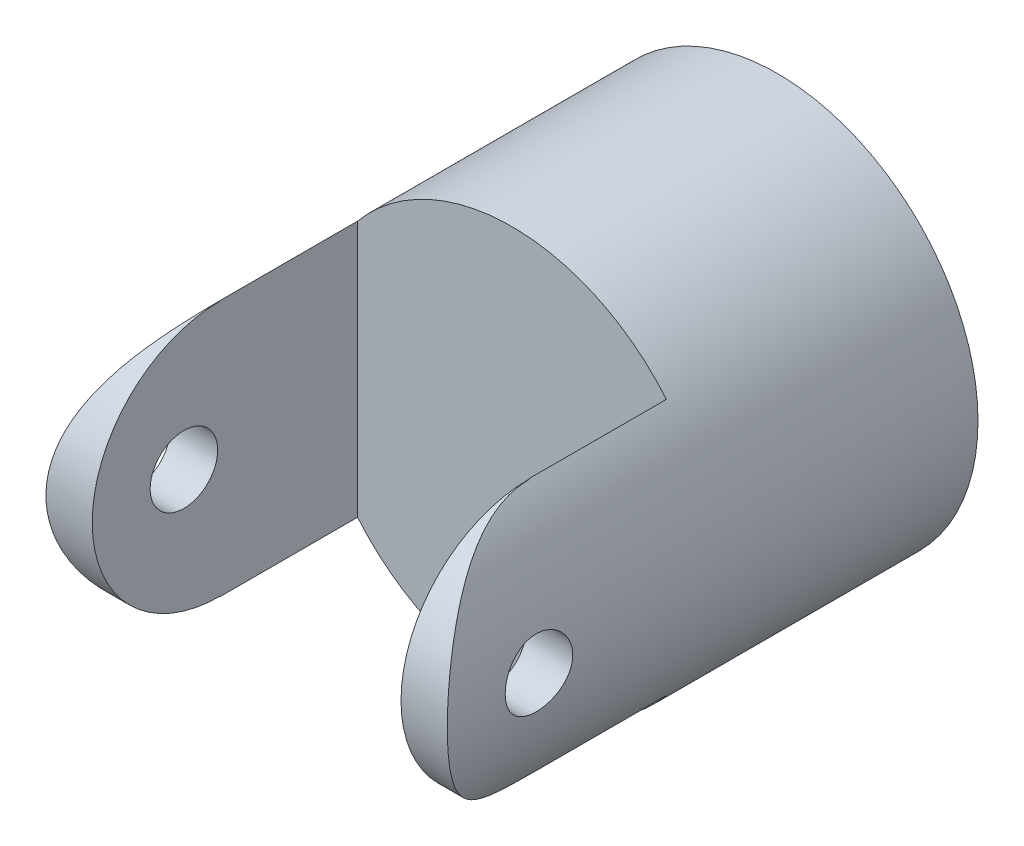
from build123d import *

# Parameters (mm, degrees)
SKETCH1_R           = 4.16
EXTRUDE1_DEPTH      = 11
EXTRUDE2_DEPTH      = 13.47442183
EXTRUDE2_DEPTH_BACK = 13.47442183
SKETCH2_W           = 6.4
SKETCH2_H           = 6.357406019
EXTRUDE3_DEPTH      = 13.47442183
EXTRUDE3_DEPTH_BACK = 13.47442183
EXTRUDE4_DEPTH      = 13.474421985
EXTRUDE4_DEPTH_BACK = 13.474421985
SKETCH4_R           = 0.7


with BuildPart() as part:
    # Sketch1 → Extrude1 (new body)
    with BuildSketch(Plane.XY):
        Circle(SKETCH1_R)
    extrude(amount=EXTRUDE1_DEPTH)

    # Sketch2 → Extrude2 (cut, two sides: drawn at the far end of the back side and taken through both)
    with BuildSketch(Plane(origin=(0, 0, 0), x_dir=(1, 0, 0), z_dir=(0, 1, 0)).offset(-EXTRUDE2_DEPTH_BACK)):
        with Locations((0, -8.67870301)):
            Rectangle(SKETCH2_W, SKETCH2_H)
    extrude(amount=EXTRUDE2_DEPTH + EXTRUDE2_DEPTH_BACK, mode=Mode.SUBTRACT)

    # Sketch3 → Extrude3 (cut, two sides: drawn at the far end of the back side and taken through both)
    with BuildSketch(Plane(origin=(0, 0, 0), x_dir=(0, 0, -1), z_dir=(1, 0, 0)).offset(-EXTRUDE3_DEPTH_BACK)):
        with BuildLine():
            Line((-8.35, 2.65), (-8.35, 3.836721977))
            Line((-8.35, 3.836721977), (-12.822156105, 3.836721977))
            Line((-12.822156105, 3.836721977), (-12.822156105, -4.605164147))
            Line((-12.822156105, -4.605164147), (-8.35, -4.492230912))
            Line((-8.35, -4.492230912), (-8.35, -2.65))
            ThreePointArc((-8.35, -2.65), (-11, 0), (-8.35, 2.65))
        make_face()
    extrude(amount=EXTRUDE3_DEPTH + EXTRUDE3_DEPTH_BACK, mode=Mode.SUBTRACT)

    # Sketch4 → Extrude4 (cut, two sides: drawn at the far end of the back side and taken through both)
    with BuildSketch(Plane(origin=(0, 0, 0), x_dir=(0, 0, -1), z_dir=(1, 0, 0)).offset(-EXTRUDE4_DEPTH_BACK)):
        with Locations((-9.1, 0)):
            Circle(SKETCH4_R)
    extrude(amount=EXTRUDE4_DEPTH + EXTRUDE4_DEPTH_BACK, mode=Mode.SUBTRACT)


solid = part.part
